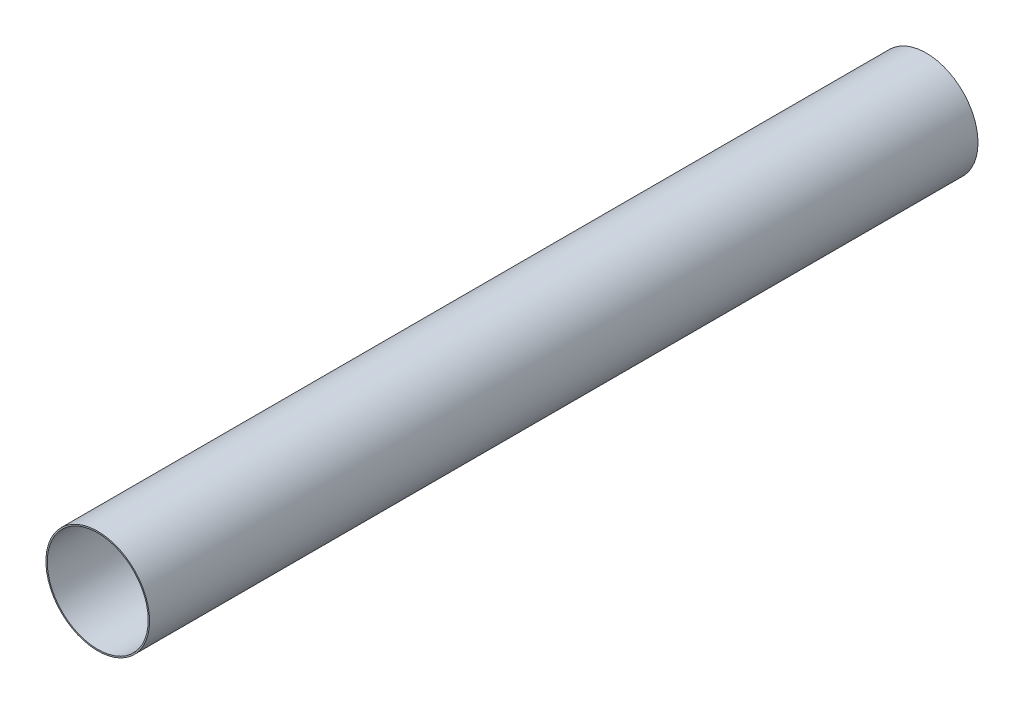
from build123d import *

# Parameters (mm, degrees)
SKETCH1_R           = 78.2
SKETCH1_R_2         = 76.2
BOSS_EXTRUDE1_DEPTH = 1250


with BuildPart() as part:
    # Sketch1 → Boss-Extrude1 (new body)
    with BuildSketch(Plane.XY):
        Circle(SKETCH1_R)
        Circle(SKETCH1_R_2, mode=Mode.SUBTRACT)
    extrude(amount=BOSS_EXTRUDE1_DEPTH)


solid = part.part
